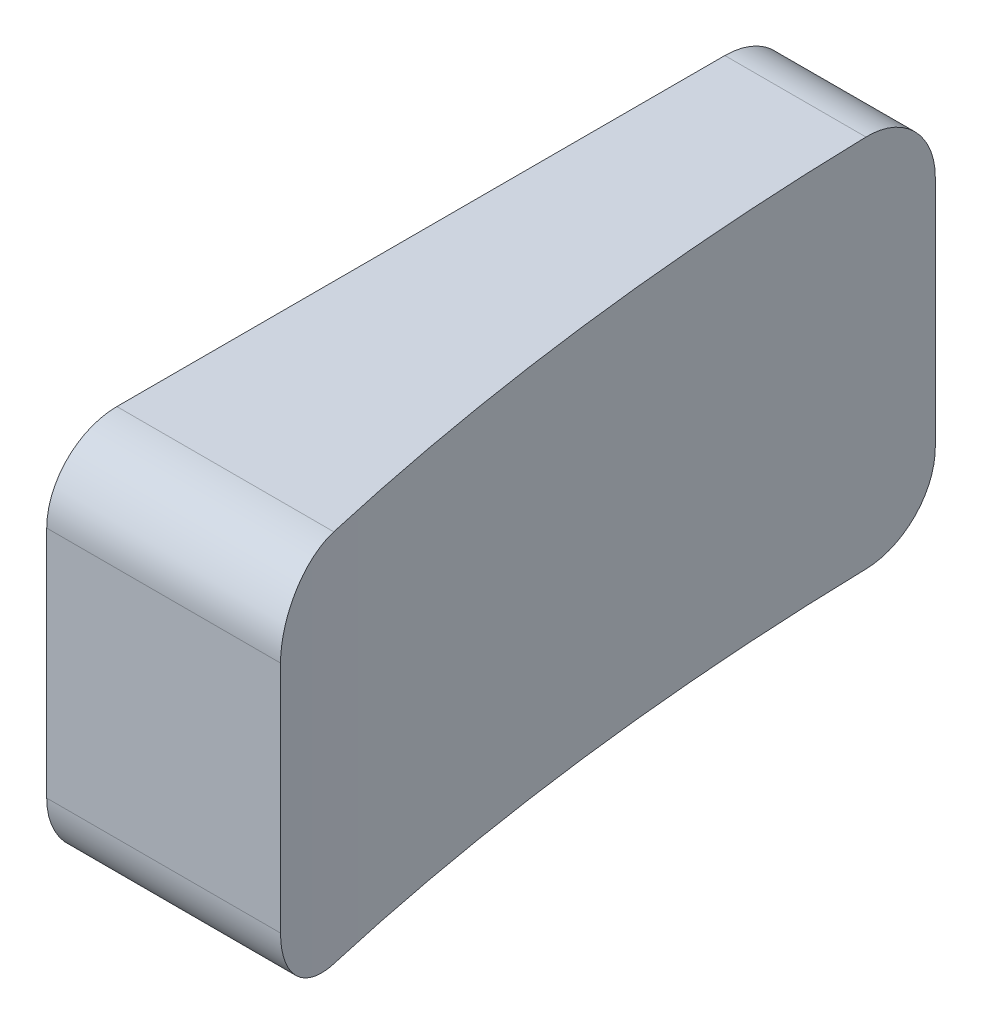
from build123d import *

# Parameters (mm, degrees)
BOSS_EXTRUDE1_DEPTH = 25.4
FILLET1_R           = 4.7625


with BuildPart() as part:
    # Sketch1 → Boss-Extrude1 (new body)
    with BuildSketch(Plane(origin=(0, 0, 0), x_dir=(1, 0, 0), z_dir=(0, 1, 0))):
        with BuildLine():
            Line((0, -25.4), (0, 25.4))
            Line((0, 25.4), (9.525, 25.4))
            ThreePointArc((9.525, 25.4), (11.118653193, -0.197668351), (15.875, -25.4))
            Line((15.875, -25.4), (0, -25.4))
        make_face()
    extrude(amount=BOSS_EXTRUDE1_DEPTH)

    # Fillet1
    fillet1_edges = [part.edges().sort_by_distance(p)[0] for p in [
        (7.9375, 25.4, 25.4),
        (4.7625, 25.4, -25.4),
        (7.9375, 0, 25.4),
        (4.7625, 0, -25.4),
    ]]
    fillet(fillet1_edges, radius=FILLET1_R)


solid = part.part
